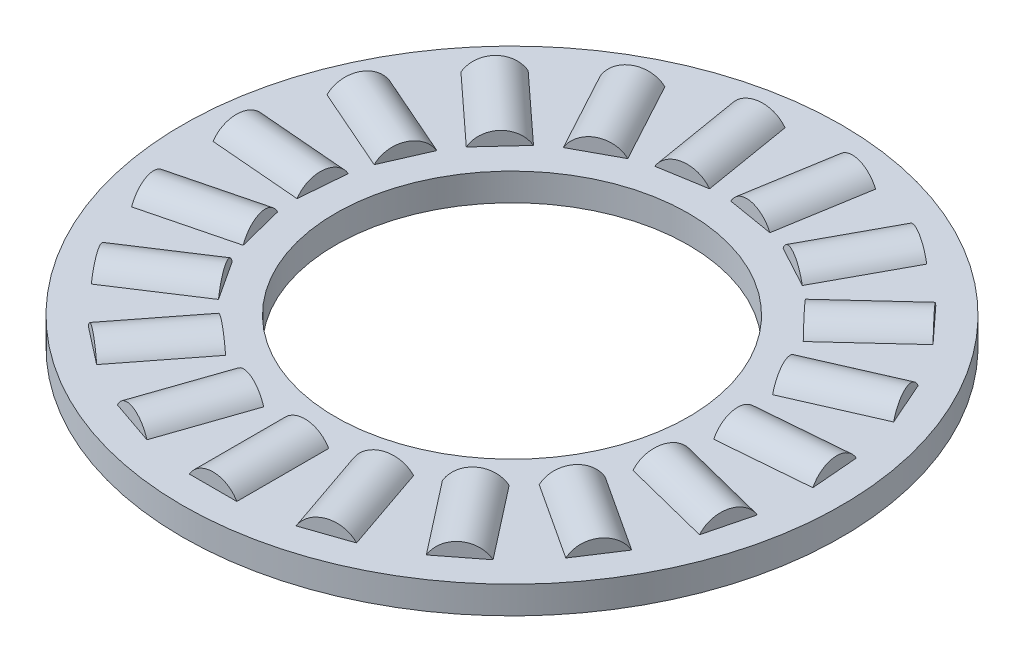
from build123d import *

# Parameters (mm, degrees)
SKETCH5_W         = 5.53085
SKETCH5_H         = 0.9921875
SKETCH3_W         = 3.31851
SKETCH3_H         = 0.9921875
SKETCH2_W         = 3.31851
SKETCH2_H         = 0.9921875
CIRPATTERN1_COUNT = 19
CIRPATTERN1_ANGLE = 341.052631579
CIRPATTERN2_COUNT = 19


with BuildPart() as part:
    # Sketch5 → Revolve3 (revolve)
    with BuildSketch(Plane(origin=(0, 0, 0), x_dir=(0, 0, -1), z_dir=(1, 0, 0)), mode=Mode.PRIVATE) as revolve3_sk:
        with Locations((-9.140825, 0)):
            Rectangle(SKETCH5_W, SKETCH5_H)
    revolve(revolve3_sk.sketch.rotate(Axis((0, -0.9921875, 0), (0, 1, 0)), 180), axis=Axis((0, -0.9921875, 0), (0, 1, 0)))

    # Sketch3 → Cut-Revolve1 (revolve, cut)
    with BuildSketch(Plane(origin=(0, 0, 0), x_dir=(0, 0, -1), z_dir=(1, 0, 0))):
        with Locations((-9.140825, 0.49609375)):
            Rectangle(SKETCH3_W, SKETCH3_H)
    cut_revolve1 = revolve(axis=Axis((0, 0, 10.80008), (0, 0, -1)), mode=Mode.SUBTRACT)

    # CirPattern2: Cut-Revolve1 ×19 about axis
    cirpattern2_axis = Axis((0, 0, 0), (0, 1, 0))
    for i in range(1, CIRPATTERN2_COUNT):
        add(cut_revolve1.rotate(cirpattern2_axis, i * 360 / CIRPATTERN2_COUNT), mode=Mode.SUBTRACT)


with BuildPart() as body_2:
    # Sketch2 → Revolve2 (revolve)
    with BuildSketch(Plane(origin=(0, 0, 0), x_dir=(0, 0, -1), z_dir=(1, 0, 0)), mode=Mode.PRIVATE) as revolve2_sk:
        with Locations((-9.140825, 0.49609375)):
            Rectangle(SKETCH2_W, SKETCH2_H)
    revolve(revolve2_sk.sketch.rotate(Axis((0, 0, 10.80008), (0, 0, -1)), 90), axis=Axis((0, 0, 10.80008), (0, 0, -1)))


with BuildPart() as cirpattern1_1:
    # CirPattern1: pattern copy
    add(body_2.part.rotate(Axis((0, 0.9921875, 0), (0, -1, 0)), 1 * CIRPATTERN1_ANGLE / (CIRPATTERN1_COUNT - 1)))


with BuildPart() as cirpattern1_2:
    # CirPattern1: pattern copy
    add(body_2.part.rotate(Axis((0, 0.9921875, 0), (0, -1, 0)), 2 * CIRPATTERN1_ANGLE / (CIRPATTERN1_COUNT - 1)))


with BuildPart() as cirpattern1_3:
    # CirPattern1: pattern copy
    add(body_2.part.rotate(Axis((0, 0.9921875, 0), (0, -1, 0)), 3 * CIRPATTERN1_ANGLE / (CIRPATTERN1_COUNT - 1)))


with BuildPart() as cirpattern1_4:
    # CirPattern1: pattern copy
    add(body_2.part.rotate(Axis((0, 0.9921875, 0), (0, -1, 0)), 4 * CIRPATTERN1_ANGLE / (CIRPATTERN1_COUNT - 1)))


with BuildPart() as cirpattern1_5:
    # CirPattern1: pattern copy
    add(body_2.part.rotate(Axis((0, 0.9921875, 0), (0, -1, 0)), 5 * CIRPATTERN1_ANGLE / (CIRPATTERN1_COUNT - 1)))


with BuildPart() as cirpattern1_6:
    # CirPattern1: pattern copy
    add(body_2.part.rotate(Axis((0, 0.9921875, 0), (0, -1, 0)), 6 * CIRPATTERN1_ANGLE / (CIRPATTERN1_COUNT - 1)))


with BuildPart() as cirpattern1_7:
    # CirPattern1: pattern copy
    add(body_2.part.rotate(Axis((0, 0.9921875, 0), (0, -1, 0)), 7 * CIRPATTERN1_ANGLE / (CIRPATTERN1_COUNT - 1)))


with BuildPart() as cirpattern1_8:
    # CirPattern1: pattern copy
    add(body_2.part.rotate(Axis((0, 0.9921875, 0), (0, -1, 0)), 8 * CIRPATTERN1_ANGLE / (CIRPATTERN1_COUNT - 1)))


with BuildPart() as cirpattern1_9:
    # CirPattern1: pattern copy
    add(body_2.part.rotate(Axis((0, 0.9921875, 0), (0, -1, 0)), 9 * CIRPATTERN1_ANGLE / (CIRPATTERN1_COUNT - 1)))


with BuildPart() as cirpattern1_10:
    # CirPattern1: pattern copy
    add(body_2.part.rotate(Axis((0, 0.9921875, 0), (0, -1, 0)), 10 * CIRPATTERN1_ANGLE / (CIRPATTERN1_COUNT - 1)))


with BuildPart() as cirpattern1_11:
    # CirPattern1: pattern copy
    add(body_2.part.rotate(Axis((0, 0.9921875, 0), (0, -1, 0)), 11 * CIRPATTERN1_ANGLE / (CIRPATTERN1_COUNT - 1)))


with BuildPart() as cirpattern1_12:
    # CirPattern1: pattern copy
    add(body_2.part.rotate(Axis((0, 0.9921875, 0), (0, -1, 0)), 12 * CIRPATTERN1_ANGLE / (CIRPATTERN1_COUNT - 1)))


with BuildPart() as cirpattern1_13:
    # CirPattern1: pattern copy
    add(body_2.part.rotate(Axis((0, 0.9921875, 0), (0, -1, 0)), 13 * CIRPATTERN1_ANGLE / (CIRPATTERN1_COUNT - 1)))


with BuildPart() as cirpattern1_14:
    # CirPattern1: pattern copy
    add(body_2.part.rotate(Axis((0, 0.9921875, 0), (0, -1, 0)), 14 * CIRPATTERN1_ANGLE / (CIRPATTERN1_COUNT - 1)))


with BuildPart() as cirpattern1_15:
    # CirPattern1: pattern copy
    add(body_2.part.rotate(Axis((0, 0.9921875, 0), (0, -1, 0)), 15 * CIRPATTERN1_ANGLE / (CIRPATTERN1_COUNT - 1)))


with BuildPart() as cirpattern1_16:
    # CirPattern1: pattern copy
    add(body_2.part.rotate(Axis((0, 0.9921875, 0), (0, -1, 0)), 16 * CIRPATTERN1_ANGLE / (CIRPATTERN1_COUNT - 1)))


with BuildPart() as cirpattern1_17:
    # CirPattern1: pattern copy
    add(body_2.part.rotate(Axis((0, 0.9921875, 0), (0, -1, 0)), 17 * CIRPATTERN1_ANGLE / (CIRPATTERN1_COUNT - 1)))


with BuildPart() as cirpattern1_18:
    # CirPattern1: pattern copy
    add(body_2.part.rotate(Axis((0, 0.9921875, 0), (0, -1, 0)), 18 * CIRPATTERN1_ANGLE / (CIRPATTERN1_COUNT - 1)))


solid = Compound([part.part, body_2.part, cirpattern1_1.part, cirpattern1_2.part, cirpattern1_3.part, cirpattern1_4.part, cirpattern1_5.part, cirpattern1_6.part, cirpattern1_7.part, cirpattern1_8.part, cirpattern1_9.part, cirpattern1_10.part, cirpattern1_11.part, cirpattern1_12.part, cirpattern1_13.part, cirpattern1_14.part, cirpattern1_15.part, cirpattern1_16.part, cirpattern1_17.part, cirpattern1_18.part])
